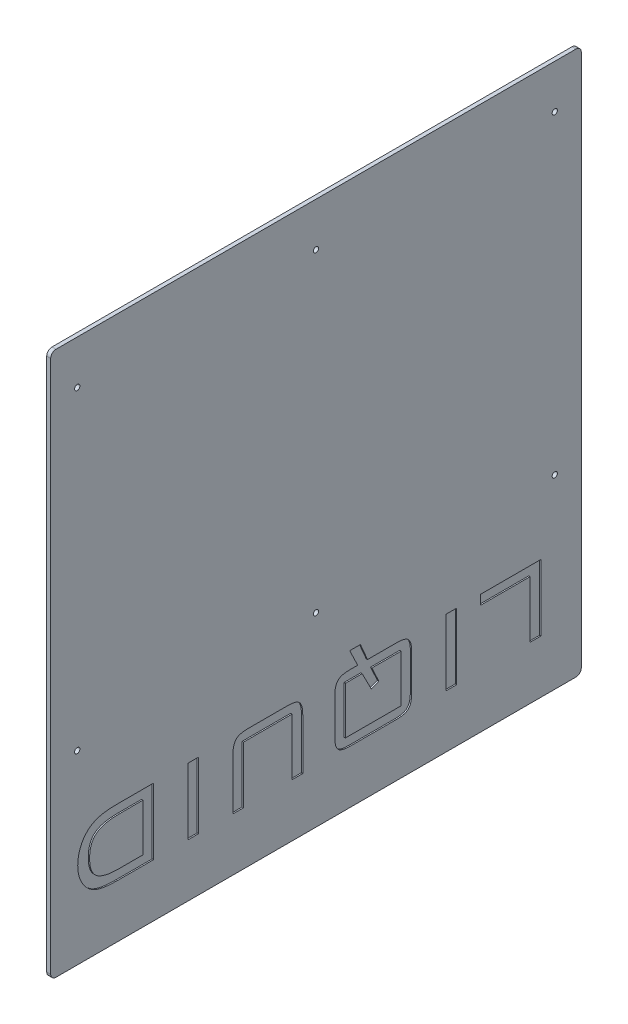
from build123d import *

# Parameters (mm, degrees)
SKETCH1_R           = 2
BOSS_EXTRUDE1_DEPTH = 3
SKETCH3_W           = 8.035714286
SKETCH3_H           = 50
CUT_EXTRUDE1_DEPTH  = 1


with BuildPart() as part:
    # Sketch1 → Boss-Extrude1 (new body)
    with BuildSketch(Plane(origin=(322.623479249, 0, 0), x_dir=(0, 0, -1), z_dir=(1, 0, 0))):
        with BuildLine():
            Line((-756.677889561, 13.839775395), (-364.677889561, 13.839775395))
            ThreePointArc((-364.677889561, 13.839775395), (-361.849462436, 15.011348271), (-360.677889561, 17.839775395))
            Line((-360.677889561, 17.839775395), (-360.677889561, 419.839775395))
            ThreePointArc((-360.677889561, 419.839775395), (-361.849462436, 422.66820252), (-364.677889561, 423.839775395))
            Line((-364.677889561, 423.839775395), (-756.677889561, 423.839775395))
            ThreePointArc((-756.677889561, 423.839775395), (-759.506316686, 422.66820252), (-760.677889561, 419.839775395))
            Line((-760.677889561, 419.839775395), (-760.677889561, 17.839775395))
            ThreePointArc((-760.677889561, 17.839775395), (-759.506316686, 15.011348271), (-756.677889561, 13.839775395))
        make_face()
        with Locations(Location((-740.677889561, 153.839775395, 0), (0, 0, 180))):
            Circle(SKETCH1_R, mode=Mode.SUBTRACT)
        with Locations(Location((-740.677889561, 390.839413535, 0), (0, 0, 180))):
            Circle(SKETCH1_R, mode=Mode.SUBTRACT)
        with Locations(Location((-380.677889561, 153.839775395, 0), (0, 0, 180))):
            Circle(SKETCH1_R, mode=Mode.SUBTRACT)
        with Locations(Location((-380.677889561, 390.839413535, 0), (0, 0, 180))):
            Circle(SKETCH1_R, mode=Mode.SUBTRACT)
        with Locations(Location((-560.677889561, 390.839413535, 0), (0, 0, 180))):
            Circle(SKETCH1_R, mode=Mode.SUBTRACT)
        with Locations(Location((-560.677889561, 153.839775395, 0), (0, 0, 180))):
            Circle(SKETCH1_R, mode=Mode.SUBTRACT)
    extrude(amount=-BOSS_EXTRUDE1_DEPTH)

    # Sketch3 → Cut-Extrude1 (cut)
    # profile 1 of 6: a face of its own
    with BuildSketch(Plane.ZY.offset(-322.623479249)):
        Polygon((391.177889561, 103.839775395), (391.177889561, 53.839775395), (399.213603847, 53.839775395), (399.213603847, 96.696918253), (436.713603847, 96.696918253), (436.713603847, 103.839775395), align=None)
    # profile 2 of 6: a face of its own
    with BuildSketch(Plane.ZY.offset(-322.623479249)):
        with Locations((458.588603847, 78.839775395)):
            Rectangle(SKETCH3_W, SKETCH3_H)
    # profile 3 of 6: a face of its own
    with BuildSketch(Plane.ZY.offset(-322.623479249)):
        with BuildLine():
            add(Edge.make_bspline(
                [(488.499318133, 65.963101288), (488.507777988, 65.404861135), (488.524081056, 64.32907117), (488.635337004, 62.787583754), (488.810379648, 61.378747142), (489.071179344, 60.113939901), (489.408282253, 58.984789475), (489.803428646, 57.98526826), (490.294983924, 57.128129402), (490.862324457, 56.388242843), (491.553632454, 55.777741867), (492.365253236, 55.258184375), (493.30648231, 54.810969822), (494.385408287, 54.455238096), (495.594959864, 54.175999809), (496.939779692, 53.99085418), (498.420495105, 53.859802089), (499.455093645, 53.846641437), (499.994853847, 53.839775395)],
                knots=[0, 0, 0, 0, 1.356221993, 2.613588442, 3.7529275, 4.803245948, 5.746909319, 6.613424892, 7.408010909, 8.14031288, 8.868419245, 9.636206373, 10.47510186, 11.393329314, 12.390914008, 13.487025728, 14.688956683, 16, 16, 16, 16], degree=3))
            Line((499.994853847, 53.839775395), (535.039496704, 53.839775395))
            add(Edge.make_bspline(
                [(535.039496704, 53.839775395), (535.574400451, 53.84887817), (536.598943495, 53.866313426), (538.073383582, 53.968325096), (539.410417733, 54.180106784), (540.618612625, 54.457531537), (541.69913383, 54.796899204), (542.646170966, 55.232764058), (543.464839846, 55.745902941), (544.15748606, 56.360822585), (544.726845579, 57.099568543), (545.209953361, 57.957595023), (545.636590553, 58.946209643), (545.95828412, 60.083095347), (546.226578639, 61.354873165), (546.397503918, 62.769266318), (546.510957192, 64.319692532), (546.526785931, 65.400184481), (546.535032418, 65.963101288)],
                knots=[0, 0, 0, 0, 1.299210286, 2.488479226, 3.585823455, 4.582994824, 5.497291421, 6.331034297, 7.108000517, 7.835805208, 8.567803767, 9.362060566, 10.222158455, 11.176253704, 12.226136976, 13.376204297, 14.633049786, 16, 16, 16, 16], degree=3))
            Line((546.535032418, 65.963101288), (546.535032418, 91.953614681))
            add(Edge.make_bspline(
                [(546.535032418, 91.953614681), (546.526596606, 92.507215039), (546.510344872, 93.573735408), (546.398873248, 95.10118502), (546.22471803, 96.496509331), (545.961094398, 97.746201081), (545.634018942, 98.863156425), (545.209622389, 99.833609334), (544.730721869, 100.67663301), (544.156308562, 101.390133875), (543.459625395, 101.975519131), (542.642712911, 102.473509104), (541.699318877, 102.910502964), (540.62032052, 103.252747424), (539.409562811, 103.5125286), (538.072225556, 103.707430379), (536.599076548, 103.814338257), (535.574446089, 103.831050237), (535.039496704, 103.839775395)],
                knots=[0, 0, 0, 0, 1.357245466, 2.61475614, 3.753224731, 4.80200455, 5.743395722, 6.6012629, 7.393257341, 8.114460715, 8.834220599, 9.61255537, 10.454283276, 11.377336392, 12.381536746, 13.487687791, 14.68834675, 16, 16, 16, 16], degree=3))
            Line((535.039496704, 103.839775395), (529.249876168, 103.839775395))
            Line((529.249876168, 103.839775395), (535.234809204, 116.339775395))
            Line((535.234809204, 116.339775395), (527.185144025, 116.339775395))
            Line((527.185144025, 116.339775395), (521.814050275, 103.839775395))
            Line((521.814050275, 103.839775395), (499.994853847, 103.839775395))
            add(Edge.make_bspline(
                [(499.994853847, 103.839775395), (499.455244897, 103.831093344), (498.421307973, 103.81445779), (496.938984676, 103.707210221), (495.595264076, 103.516010417), (494.384669098, 103.239977593), (493.31073192, 102.87827247), (492.361116697, 102.452813954), (491.558858931, 101.927902921), (490.861829418, 101.335067124), (490.299502818, 100.609690809), (489.799265715, 99.776359966), (489.408604648, 98.79226435), (489.075067099, 97.685933028), (488.806568994, 96.445833922), (488.637685768, 95.068446281), (488.523136164, 93.555229043), (488.507482079, 92.502589282), (488.499318133, 91.953614681)],
                knots=[0, 0, 0, 0, 1.324586597, 2.538021266, 3.64545599, 4.653345889, 5.581058773, 6.423763498, 7.199481985, 7.927542786, 8.658461541, 9.441536144, 10.306446208, 11.248929857, 12.276599877, 13.416389652, 14.652590838, 16, 16, 16, 16], degree=3))
            Line((488.499318133, 91.953614681), (488.499318133, 65.963101288))
        make_face()
        Polygon((525.929563668, 96.696918253), (538.499318133, 96.696918253), (538.499318133, 60.982632538), (496.535032418, 60.982632538), (496.535032418, 96.696918253), (518.549541347, 96.696918253), (513.317956525, 85.466449503), (519.023871704, 83.30406111), align=None, mode=Mode.SUBTRACT)
    # profile 4 of 6: a face of its own
    with BuildSketch(Plane.ZY.offset(-322.623479249)):
        with BuildLine():
            Line((578.677889561, 53.839775395), (578.677889561, 96.696918253))
            Line((578.677889561, 96.696918253), (615.285032418, 96.696918253))
            Line((615.285032418, 96.696918253), (615.285032418, 53.839775395))
            Line((615.285032418, 53.839775395), (623.320746704, 53.839775395))
            Line((623.320746704, 53.839775395), (623.320746704, 91.842007538))
            add(Edge.make_bspline(
                [(623.320746704, 91.842007538), (623.312342532, 92.400262829), (623.296146772, 93.476081966), (623.184154087, 95.017369099), (623.012107655, 96.422348368), (622.744829106, 97.680621204), (622.419010897, 98.806594928), (621.9994102, 99.789106547), (621.512125562, 100.636207132), (620.942954256, 101.361634186), (620.251642943, 101.957884321), (619.439915078, 102.463190342), (618.502518399, 102.89392069), (617.428332859, 103.237688459), (616.225211702, 103.517173195), (614.885534406, 103.705983686), (613.417419816, 103.814390253), (612.39738961, 103.831091972), (611.867063668, 103.839775395)],
                knots=[0, 0, 0, 0, 1.365025829, 2.630554399, 3.777289411, 4.823296905, 5.773086012, 6.639126, 7.429026898, 8.157168554, 8.882463115, 9.649102086, 10.488604984, 11.398409027, 12.402469484, 13.50569655, 14.703181711, 16, 16, 16, 16], degree=3))
            Line((611.867063668, 103.839775395), (582.054005633, 103.839775395))
            add(Edge.make_bspline(
                [(582.054005633, 103.839775395), (581.523759919, 103.830517279), (580.503884024, 103.812710196), (579.038601966, 103.712175793), (577.710758937, 103.499716815), (576.516911901, 103.221447956), (575.44270976, 102.883164031), (574.509343771, 102.433619447), (573.696051853, 101.921170359), (573.024486953, 101.3006207), (572.445239727, 100.579648513), (571.967806965, 99.721228456), (571.545913459, 98.741183872), (571.215651795, 97.620804081), (570.952575448, 96.370906004), (570.779117162, 94.980230209), (570.666341571, 93.457517621), (570.650456684, 92.395617361), (570.642175275, 91.842007538)],
                knots=[0, 0, 0, 0, 1.301446602, 2.503205558, 3.60080036, 4.597332017, 5.510383128, 6.357737689, 7.133266863, 7.860254787, 8.590995162, 9.393593455, 10.262724318, 11.204977956, 12.254718625, 13.394230236, 14.64151108, 16, 16, 16, 16], degree=3))
            Line((570.642175275, 91.842007538), (570.642175275, 53.839775395))
            Line((570.642175275, 53.839775395), (578.677889561, 53.839775395))
        make_face()
    # profile 5 of 6: a face of its own
    with BuildSketch(Plane.ZY.offset(-322.623479249)):
        with Locations((653.23146099, 78.839775395)):
            Rectangle(SKETCH3_W, SKETCH3_H)
    # profile 6 of 6: a face of its own
    with BuildSketch(Plane.ZY.offset(-322.623479249)):
        with BuildLine():
            add(Edge.make_bspline(
                [(710.346416347, 53.839775395), (711.462829561, 53.847609583), (713.599621389, 53.862604056), (716.652009784, 54.053390606), (719.415629716, 54.316348051), (721.900509714, 54.718076863), (724.154468338, 55.250139941), (726.208634485, 55.918213495), (728.096541909, 56.714766253), (729.237791909, 57.389367827), (729.79396099, 57.71812361)],
                knots=[0, 0, 0, 0, 1.333778163, 2.552823848, 3.653108193, 4.649746513, 5.558133507, 6.417402386, 7.228747549, 8, 8, 8, 8], degree=3))
            add(Edge.make_bspline(
                [(729.79396099, 57.71812361), (730.584276134, 58.272265925), (732.164841991, 59.380505376), (734.213100137, 61.455805055), (736.021889102, 63.795388508), (737.541263715, 66.411146351), (738.769832951, 69.237594697), (739.649509394, 72.221554129), (740.178248507, 75.337950034), (740.249059987, 77.456583815), (740.285032418, 78.532855753)],
                knots=[0, 0, 0, 0, 0.952297785, 1.904517931, 2.867930349, 3.869019748, 4.885904814, 5.906780791, 6.936638737, 8, 8, 8, 8], degree=3))
            add(Edge.make_bspline(
                [(740.285032418, 78.532855753), (740.255350038, 79.674182917), (740.197239132, 81.908624837), (739.668878039, 85.16813156), (738.799664091, 88.247251057), (737.606538522, 91.137804797), (736.088691959, 93.794204112), (734.272317512, 96.164988495), (732.204336886, 98.278930575), (730.599326367, 99.399264028), (729.79396099, 99.961427181)],
                knots=[0, 0, 0, 0, 1.100129358, 2.153786604, 3.174592563, 4.179911314, 5.162319574, 6.115853573, 7.05456925, 8, 8, 8, 8], degree=3))
            add(Edge.make_bspline(
                [(729.79396099, 99.961427181), (729.251076779, 100.279470342), (728.125585016, 100.938828176), (726.271583672, 101.735320549), (724.221353469, 102.386917467), (721.975591048, 102.933805949), (719.476710019, 103.35116619), (716.699245313, 103.629283713), (713.622777103, 103.816196095), (711.472099865, 103.831674081), (710.346416347, 103.839775395)],
                knots=[0, 0, 0, 0, 0.751413761, 1.557809164, 2.404944974, 3.320203742, 4.317937033, 5.430050062, 6.654865437, 8, 8, 8, 8], degree=3))
            Line((710.346416347, 103.839775395), (683.142175275, 103.839775395))
            Line((683.142175275, 103.839775395), (683.142175275, 53.839775395))
            Line((683.142175275, 53.839775395), (710.346416347, 53.839775395))
        make_face()
        with BuildLine():
            Line((709.160590454, 60.982632538), (691.177889561, 60.982632538))
            Line((691.177889561, 60.982632538), (691.177889561, 96.696918253))
            Line((691.177889561, 96.696918253), (709.160590454, 96.696918253))
            add(Edge.make_bspline(
                [(709.160590454, 96.696918253), (710.137513201, 96.683626037), (712.019017056, 96.658025902), (714.729439528, 96.461077109), (717.219393924, 96.15041247), (719.488890467, 95.697713362), (721.529887708, 95.09458462), (723.36199902, 94.394096259), (724.969543094, 93.542939797), (726.357367991, 92.540432301), (727.557920659, 91.386969833), (728.577493486, 90.061361067), (729.450599354, 88.572987278), (730.142544976, 86.9024221), (730.703316233, 85.07290387), (731.087350144, 83.066538659), (731.305523322, 80.890773132), (731.339057889, 79.384372155), (731.35646099, 78.602610217)],
                knots=[0, 0, 0, 0, 1.40931624, 2.714271877, 3.918424909, 5.027624621, 6.048757475, 6.985660279, 7.853111911, 8.665027323, 9.447928266, 10.246427284, 11.070312611, 11.930128696, 12.849083366, 13.826707191, 14.872147839, 16, 16, 16, 16], degree=3))
            add(Edge.make_bspline(
                [(731.35646099, 78.602610217), (731.340938822, 77.848486216), (731.31096218, 76.39211065), (731.066162816, 74.288744215), (730.697238542, 72.341862631), (730.108793884, 70.572512748), (729.404967351, 68.948758543), (728.525872024, 67.491608475), (727.477349087, 66.201868166), (726.263982447, 65.071317561), (724.852466618, 64.095207701), (723.236076287, 63.263375104), (721.407193251, 62.552853431), (719.366423119, 61.970803447), (717.110956249, 61.533566744), (714.650594896, 61.217952771), (711.977177368, 61.021665067), (710.123555482, 60.995977399), (709.160590454, 60.982632538)],
                knots=[0, 0, 0, 0, 1.1029475, 2.130028734, 3.094733, 3.996236287, 4.852145578, 5.679426148, 6.477428238, 7.276560664, 8.097578654, 8.980088779, 9.930191586, 10.963809582, 12.080624623, 13.288249086, 14.591233026, 16, 16, 16, 16], degree=3))
        make_face(mode=Mode.SUBTRACT)
    extrude(amount=CUT_EXTRUDE1_DEPTH, mode=Mode.SUBTRACT)


solid = part.part
